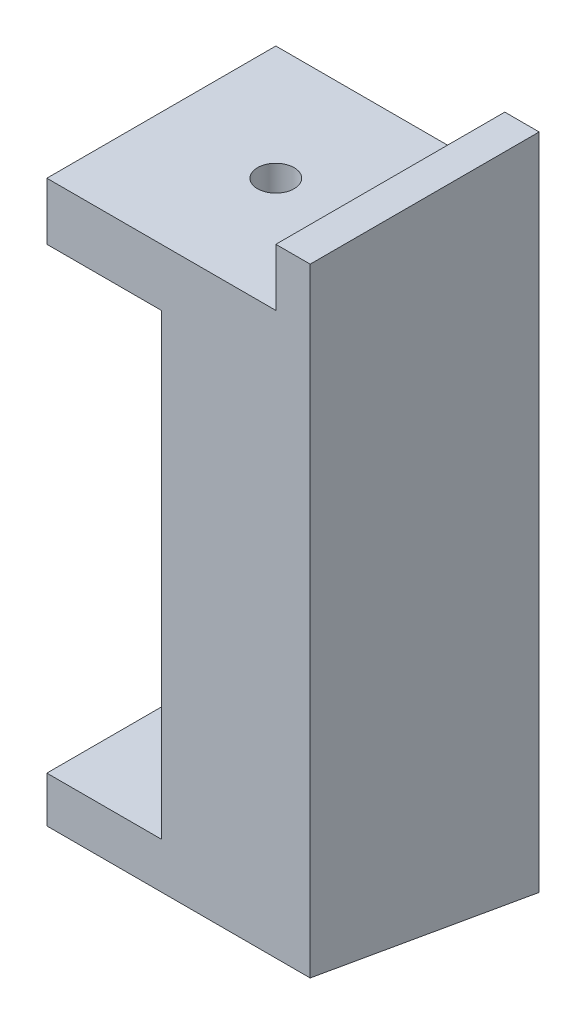
from build123d import *

# Parameters (mm, degrees)
BOSS_EXTRUDE1_DEPTH = 20
SKETCH3_R           = 1.6
CUT_EXTRUDE1_DEPTH  = 20
BOSS_EXTRUDE2_DEPTH = 40
FILLET1_R           = 2
BOSS_EXTRUDE3_DEPTH = 23
SKETCH6_R           = 3.2
CUT_EXTRUDE2_DEPTH  = 13


with BuildPart() as part:
    # Sketch2 → Boss-Extrude1 (new body)
    with BuildSketch(Plane.XY):
        Polygon((-10, 2.5), (10, 2.5), (10, 7.5), (13, 7.5), (13, -2.5), (10, -2.5), (-10, -2.5), align=None)
    extrude(amount=BOSS_EXTRUDE1_DEPTH)

    # Sketch3 → Cut-Extrude1 (cut)
    with BuildSketch(Plane(origin=(0, 2.5, 0), x_dir=(1, 0, 0), z_dir=(0, 1, 0))):
        with Locations(Location((0, -10, 0), (0, 0, 270))):
            Circle(SKETCH3_R)
    extrude(amount=-CUT_EXTRUDE1_DEPTH, mode=Mode.SUBTRACT)

    # Sketch4 → Boss-Extrude2 (add)
    with BuildSketch(Plane.XZ.offset(2.5)):
        Polygon((13, 0), (8, 0), (0, 0), (0, 3), (8, 3), (8, 17), (0, 17), (0, 20), (8, 20), (13, 20), align=None)
    extrude(amount=BOSS_EXTRUDE2_DEPTH)

    # Fillet1
    fillet1_edges = [part.edges().sort_by_distance(p)[0] for p in [
        (8, -22.5, 17),
        (8, -22.5, 3),
    ]]
    fillet(fillet1_edges, radius=FILLET1_R)

    # Sketch5 → Boss-Extrude3 (add)
    with BuildSketch(Plane(origin=(13, 0, 0), x_dir=(0, 0, -1), z_dir=(1, 0, 0))):
        Polygon((-20, -42.5), (-20, -46.5), (0, -50.026539614), (0, -42.5), align=None)
    extrude(amount=-BOSS_EXTRUDE3_DEPTH)

    # Sketch6 → Cut-Extrude2 (cut)
    with BuildSketch(Plane(origin=(0, -42.5, 0), x_dir=(1, 0, 0), z_dir=(0, 1, 0))):
        with Locations(Location((-1, -10, 0), (0, 0, 180))):
            Circle(SKETCH6_R)
    extrude(amount=-CUT_EXTRUDE2_DEPTH, mode=Mode.SUBTRACT)


solid = part.part
